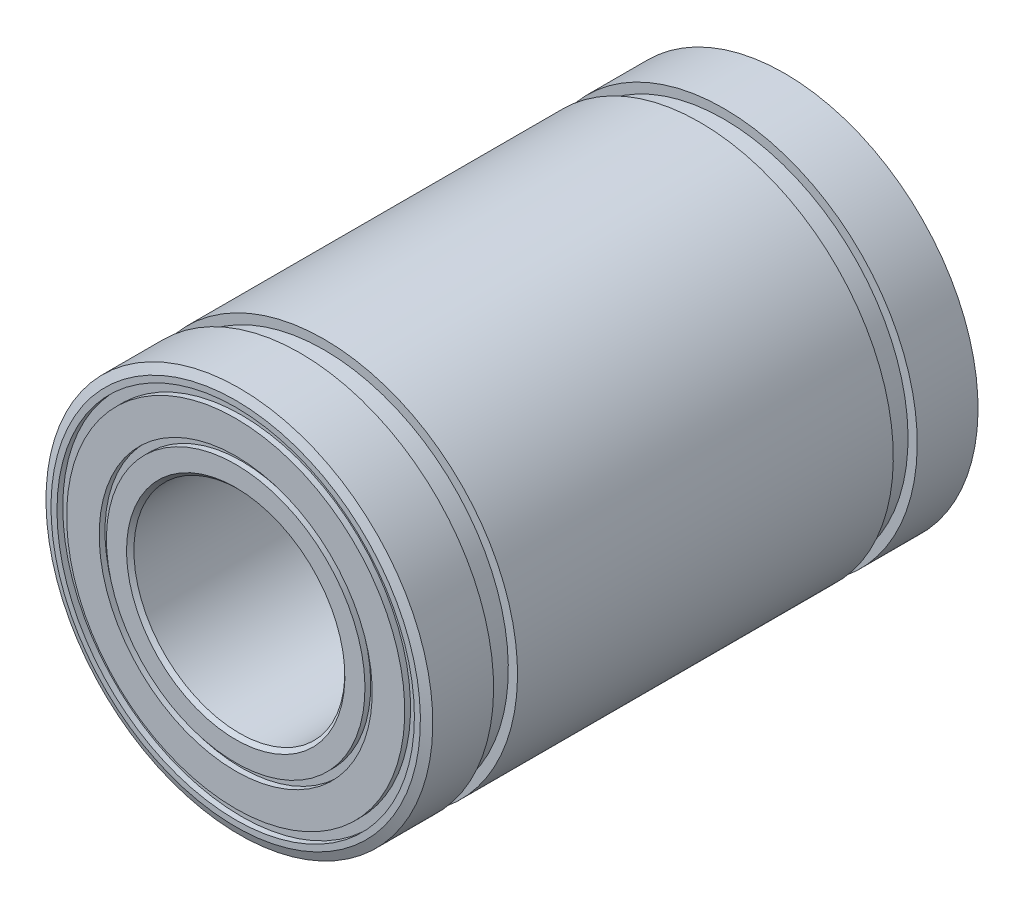
from build123d import *


with BuildPart() as part:
    # Sketch1 → Revolve1 (revolve)
    with BuildSketch(Plane.XZ, mode=Mode.PRIVATE) as revolve1_sk:
        Polygon((6.495238095, 15.714285714), (6.285714286, 15.504761905), (6.285714286, -15.504761905), (6.495238095, -15.714285714), (7.637142857, -15.714285714), (7.637142857, -15.384285714), (8.049642857, -15.384285714), (8.049642857, -15.714285714), (9.9, -15.714285714), (9.9, -15.384285714), (10.45, -15.384285714), (10.45, -15.714285714), (10.79047619, -15.714285714), (11.285714286, -15.504761905), (11.285714286, -12.047619048), (10.761904762, -12.047619048), (10.761904762, -10.685714286), (11.285714286, -10.685714286), (11.285714286, 10.685714286), (10.761904762, 10.685714286), (10.761904762, 12.047619048), (11.285714286, 12.047619048), (11.285714286, 15.504761905), (10.79047619, 15.714285714), (10.45, 15.714285714), (10.45, 15.384285714), (9.9, 15.384285714), (9.9, 15.714285714), (8.049642857, 15.714285714), (8.049642857, 15.384285714), (7.637142857, 15.384285714), (7.637142857, 15.714285714), align=None)
    revolve(revolve1_sk.sketch.rotate(Axis((0.285714286, 0, 15.714285714), (0, 0, -1)), 270), axis=Axis((0.285714286, 0, 15.714285714), (0, 0, -1)))


solid = part.part
